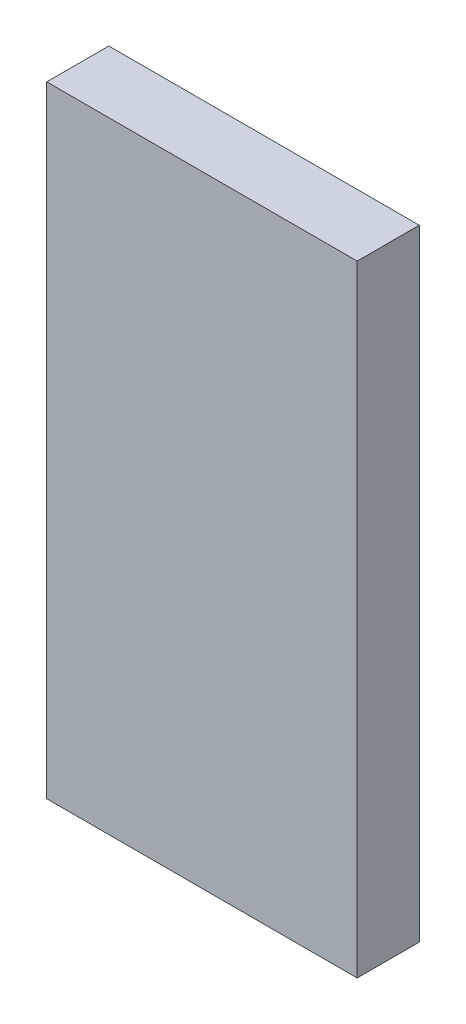
from build123d import *

# Parameters (mm, degrees)
SKETCH2_W           = 60
SKETCH2_H           = 120
BOSS_EXTRUDE1_DEPTH = 12


with BuildPart() as part:
    # Sketch2 → Boss-Extrude1 (new body)
    with BuildSketch(Plane.XY):
        with Locations((0, 60)):
            Rectangle(SKETCH2_W, SKETCH2_H)
    extrude(amount=BOSS_EXTRUDE1_DEPTH)


solid = part.part
